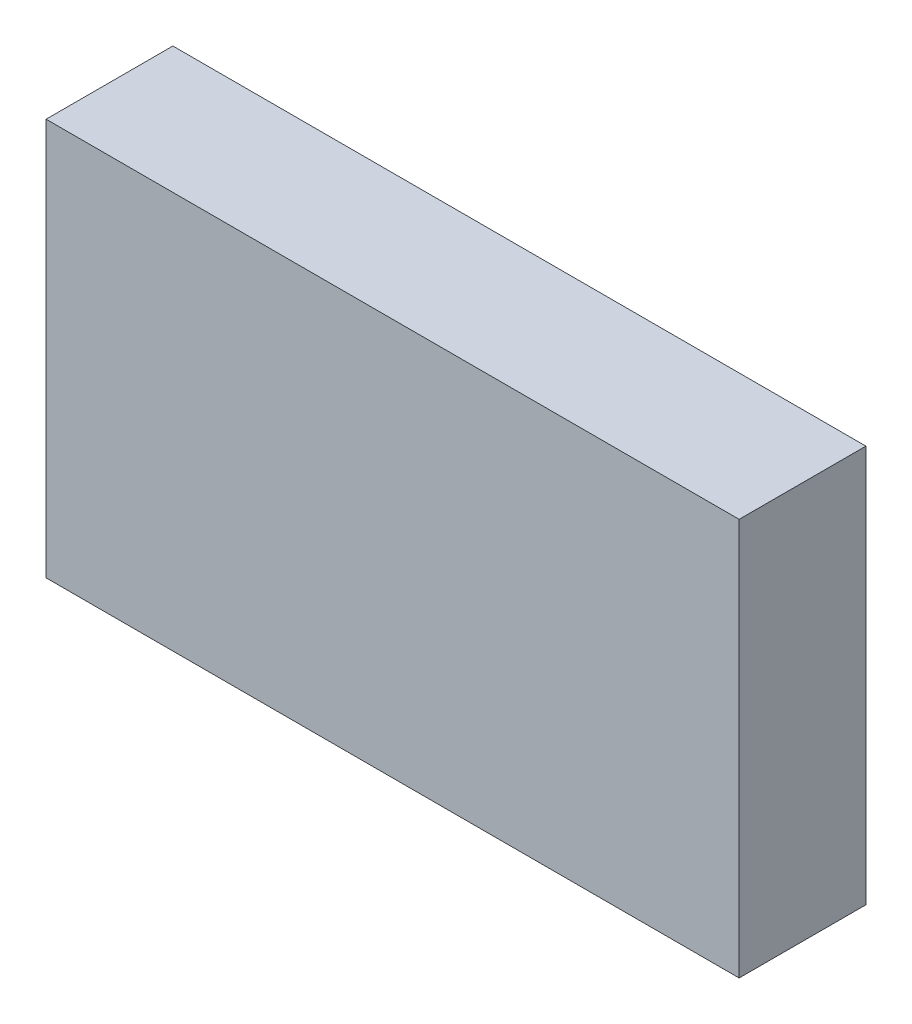
from build123d import *

# Parameters (mm, degrees)
ESQUISSE1_W        = 16.4
ESQUISSE1_H        = 9.4
BOSS_EXTRU_1_DEPTH = 3


with BuildPart() as part:
    # Esquisse1 → Boss.-Extru.1 (new body)
    with BuildSketch(Plane.XY):
        with Locations((8.2, 4.7)):
            Rectangle(ESQUISSE1_W, ESQUISSE1_H)
    extrude(amount=BOSS_EXTRU_1_DEPTH)


solid = part.part
